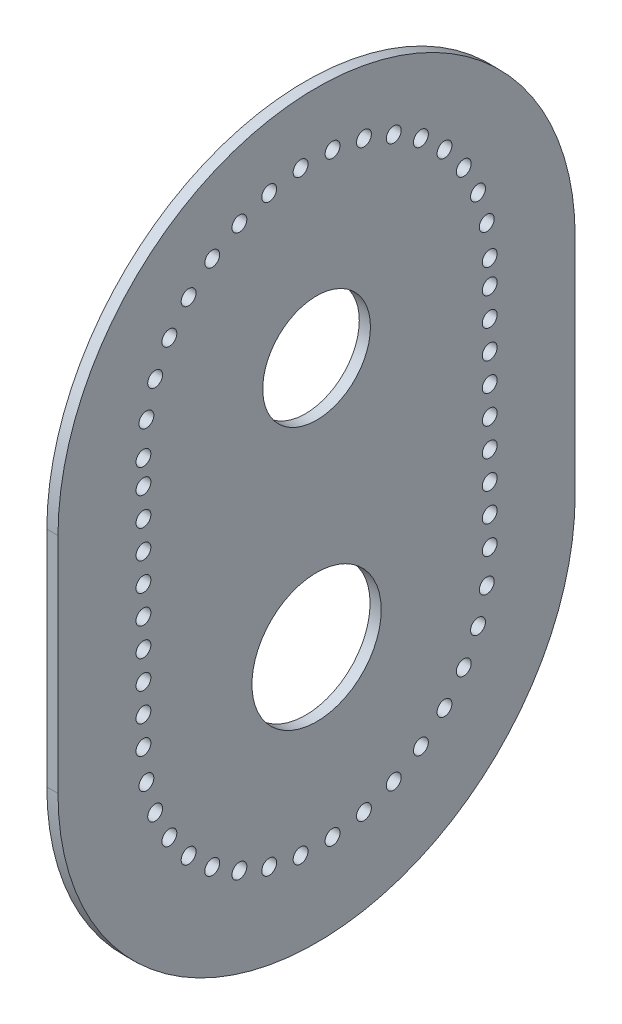
from build123d import *

# Parameters (mm, degrees)
SKETCH1_R           = 24.16125
SKETCH1_R_2         = 28.9935
BOSS_EXTRUDE1_DEPTH = 5
SCALE1_SCALE        = 1.5
SKETCH2_R           = 5
CUT_EXTRUDE1_DEPTH  = 10


with BuildPart() as part:
    # Sketch1 → Boss-Extrude1 (new body)
    with BuildSketch(Plane(origin=(0, 0, 0), x_dir=(0, 0, -1), z_dir=(1, 0, 0))):
        with BuildLine():
            Line((116, 50.1), (116, -50.1))
            ThreePointArc((116, -50.1), (0, -166.1), (-116, -50.1))
            Line((-116, -50.1), (-116, 50.1))
            ThreePointArc((-116, 50.1), (0, 166.1), (116, 50.1))
        make_face()
        with Locations((0, 61.077179293)):
            Circle(SKETCH1_R, mode=Mode.SUBTRACT)
        with Locations((0, -51.244320707)):
            Circle(SKETCH1_R_2, mode=Mode.SUBTRACT)
    extrude(amount=BOSS_EXTRUDE1_DEPTH)


with BuildPart() as part_1:
    # Scale1: scaled about (2.5, 0.381982972, 0)
    add(part.part.scale(SCALE1_SCALE).moved(Location((-1.25, -0.190991486, 0))))

    # Sketch2 → Cut-Extrude1 (cut)
    with BuildSketch(Plane(origin=(6.25, 0, 0), x_dir=(0, 0, -1), z_dir=(1, 0, 0))):
        with Locations((116.5, -58.057472547)):
            Circle(SKETCH2_R)
        with Locations((116.5, -77.057472547)):
            Circle(SKETCH2_R)
        with Locations((114.516366113, -98.464291372)):
            Circle(SKETCH2_R)
        with Locations((108.633014726, -119.142126657)):
            Circle(SKETCH2_R)
        with Locations((116.5, -20.057472547)):
            Circle(SKETCH2_R)
        with Locations((116.5, -1.057472547)):
            Circle(SKETCH2_R)
        with Locations((116.5, 17.942527453)):
            Circle(SKETCH2_R)
        with Locations((116.5, 36.942527453)):
            Circle(SKETCH2_R)
        with Locations((116.5, 55.942527453)):
            Circle(SKETCH2_R)
        with Locations((116.5, 74.942527453)):
            Circle(SKETCH2_R)
        with Locations((116.5, 91.424777453)):
            Circle(SKETCH2_R)
        with Locations((114.516366113, 112.831596279)):
            Circle(SKETCH2_R)
        with Locations((108.633014726, 133.509431564)):
            Circle(SKETCH2_R)
        with Locations((86.094538856, 169.910319938)):
            Circle(SKETCH2_R)
        with Locations((70.206935138, 184.393784431)):
            Circle(SKETCH2_R)
        with Locations((51.928518448, 195.711300896)):
            Circle(SKETCH2_R)
        with Locations((31.881738343, 203.477464883)):
            Circle(SKETCH2_R)
        with Locations((10.749263877, 207.427808992)):
            Circle(SKETCH2_R)
        with Locations((-10.749263877, 207.427808992)):
            Circle(SKETCH2_R)
        with Locations((-31.881738343, 203.477464883)):
            Circle(SKETCH2_R)
        with Locations((-51.928518448, 195.711300896)):
            Circle(SKETCH2_R)
        with Locations((-70.206935138, 184.393784431)):
            Circle(SKETCH2_R)
        with Locations((-86.094538856, 169.910319938)):
            Circle(SKETCH2_R)
        with Locations((-99.050296312, 152.754124429)):
            Circle(SKETCH2_R)
        with Locations((-108.633014726, 133.509431564)):
            Circle(SKETCH2_R)
        with Locations((-114.516366113, 112.831596279)):
            Circle(SKETCH2_R)
        with Locations((-116.5, 91.424777453)):
            Circle(SKETCH2_R)
        with Locations((-116.5, 74.942527453)):
            Circle(SKETCH2_R)
        with Locations((-116.5, 55.942527453)):
            Circle(SKETCH2_R)
        with Locations((-116.5, 36.942527453)):
            Circle(SKETCH2_R)
        with Locations((-116.5, 17.942527453)):
            Circle(SKETCH2_R)
        with Locations((-116.5, -1.057472547)):
            Circle(SKETCH2_R)
        with Locations((-116.5, -20.057472547)):
            Circle(SKETCH2_R)
        with Locations((-116.5, -39.057472547)):
            Circle(SKETCH2_R)
        with Locations((-116.5, -58.057472547)):
            Circle(SKETCH2_R)
        with Locations((-116.5, -77.057472547)):
            Circle(SKETCH2_R)
        with Locations((-114.516366113, -98.464291372)):
            Circle(SKETCH2_R)
        with Locations((-108.633014726, -119.142126657)):
            Circle(SKETCH2_R)
        with Locations((-99.050296312, -138.386819522)):
            Circle(SKETCH2_R)
        with Locations((-86.094538856, -155.543015032)):
            Circle(SKETCH2_R)
        with Locations((-70.206935138, -170.026479525)):
            Circle(SKETCH2_R)
        with Locations((-51.928518448, -181.34399599)):
            Circle(SKETCH2_R)
        with Locations((-31.881738343, -189.110159976)):
            Circle(SKETCH2_R)
        with Locations((-10.749263877, -193.060504085)):
            Circle(SKETCH2_R)
        with Locations((10.749263877, -193.060504085)):
            Circle(SKETCH2_R)
        with Locations((31.881738343, -189.110159976)):
            Circle(SKETCH2_R)
        with Locations((51.928518448, -181.34399599)):
            Circle(SKETCH2_R)
        with Locations((70.206935138, -170.026479525)):
            Circle(SKETCH2_R)
        with Locations((99.050296313, -138.386819522)):
            Circle(SKETCH2_R)
        with Locations((86.094538856, -155.543015031)):
            Circle(SKETCH2_R)
        with Locations((116.5, -39.057472547)):
            Circle(SKETCH2_R)
        with Locations((99.050296313, 152.754124429)):
            Circle(SKETCH2_R)
    extrude(amount=-CUT_EXTRUDE1_DEPTH, mode=Mode.SUBTRACT)


solid = part_1.part
